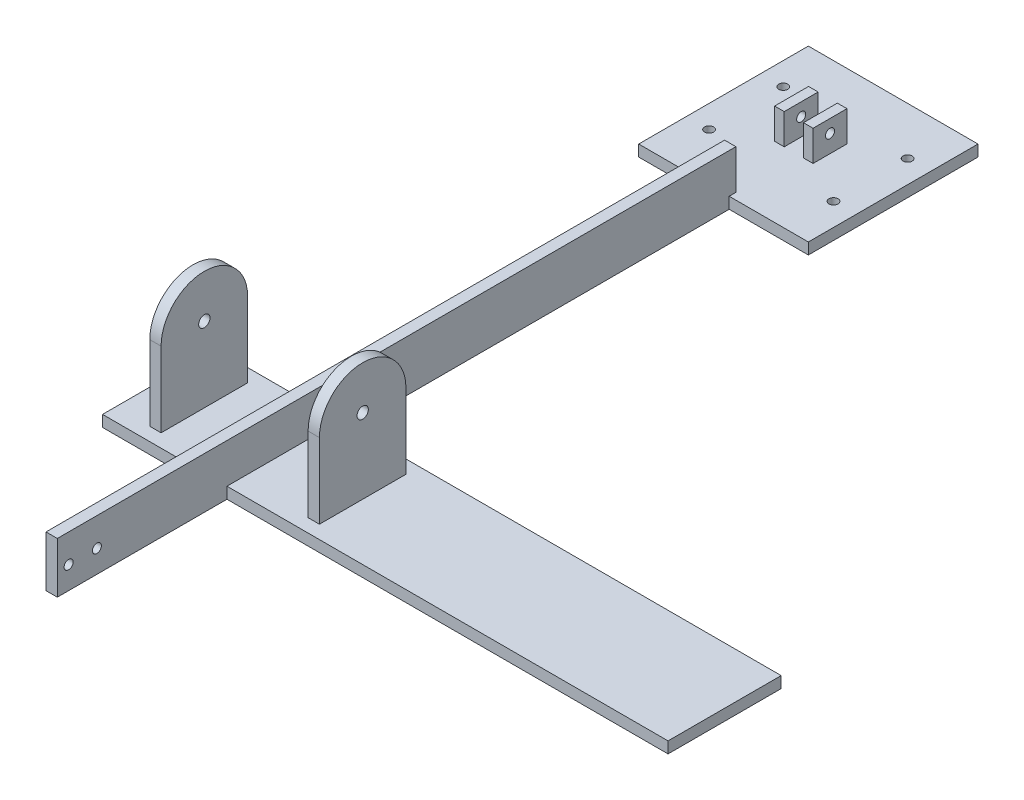
from build123d import *

# Parameters (mm, degrees)
SKETCH2_W           = 150
SKETCH2_H           = 150
SKETCH2_R           = 4
BOSS_EXTRUDE2_DEPTH = 10
SKETCH3_W           = 10
SKETCH3_H           = 600
BOSS_EXTRUDE3_DEPTH = 45
SKETCH4_W           = 500
SKETCH4_H           = 100
BOSS_EXTRUDE4_DEPTH = 10
SKETCH5_R           = 5
BOSS_EXTRUDE5_DEPTH = 10
SKETCH7_W           = 30
SKETCH7_H           = 27
SKETCH7_R           = 4
BOSS_EXTRUDE6_DEPTH = 8.5
SKETCH8_R           = 4
CUT_EXTRUDE1_DEPTH  = 720.805795864


with BuildPart() as part:
    # Sketch2 → Boss-Extrude2 (new body)
    with BuildSketch(Plane(origin=(0, 0, 0), x_dir=(1, 0, 0), z_dir=(0, 1, 0))):
        with Locations((-75, 75)):
            Rectangle(SKETCH2_W, SKETCH2_H)
        with Locations(Location((-130, 42.241144312, 0), (0, 0, 270))):
            Circle(SKETCH2_R, mode=Mode.SUBTRACT)
        with Locations(Location((-20, 42.241144312, 0), (0, 0, 270))):
            Circle(SKETCH2_R, mode=Mode.SUBTRACT)
        with Locations(Location((-20, 107.758855688, 0), (0, 0, 90))):
            Circle(SKETCH2_R, mode=Mode.SUBTRACT)
        with Locations(Location((-130, 107.758855688, 0), (0, 0, 90))):
            Circle(SKETCH2_R, mode=Mode.SUBTRACT)
    extrude(amount=BOSS_EXTRUDE2_DEPTH)

    # Sketch3 → Boss-Extrude3 (add)
    with BuildSketch(Plane(origin=(0, 0, 0), x_dir=(1, 0, 0), z_dir=(0, 1, 0))):
        with Locations((-75, -294.045278836)):
            Rectangle(SKETCH3_W, SKETCH3_H)
    extrude(amount=BOSS_EXTRUDE3_DEPTH)

    # Sketch4 → Boss-Extrude4 (add)
    with BuildSketch(Plane(origin=(0, 0, 0), x_dir=(1, 0, 0), z_dir=(0, 1, 0))):
        with Locations((70, -394.045278836)):
            Rectangle(SKETCH4_W, SKETCH4_H)
    extrude(amount=BOSS_EXTRUDE4_DEPTH)

    # Sketch5 → Boss-Extrude5 (add)
    with BuildSketch(Plane(origin=(0, 0, 0), x_dir=(0, 0, -1), z_dir=(1, 0, 0))):
        with BuildLine():
            Line((-432.285278836, 10), (-432.285278836, 76.348788506))
            ThreePointArc((-432.285278836, 76.348788506), (-421.085042149, 103.388551818), (-394.045278836, 114.588788506))
            ThreePointArc((-394.045278836, 114.588788506), (-367.005515524, 103.388551818), (-355.805278836, 76.348788506))
            Line((-355.805278836, 76.348788506), (-355.805278836, 10))
            Line((-355.805278836, 10), (-432.285278836, 10))
        make_face()
        with Locations((-394.045278836, 76.348788506)):
            Circle(SKETCH5_R, mode=Mode.SUBTRACT)
    boss_extrude5 = extrude(amount=-BOSS_EXTRUDE5_DEPTH)

    # Mirror1: Boss-Extrude5 across plane
    add(boss_extrude5.mirror(Plane(origin=(-75, 0, 0), x_dir=(0, 0, 1), z_dir=(1, 0, 0))))

    # Sketch7 → Boss-Extrude6 (add)
    with BuildSketch(Plane(origin=(-58, 0, 0), x_dir=(0, 0, -1), z_dir=(1, 0, 0))):
        with Locations((77.164979512, 23.5)):
            Rectangle(SKETCH7_W, SKETCH7_H)
        with Locations((77.164979512, 25.524498442)):
            Circle(SKETCH7_R, mode=Mode.SUBTRACT)
    boss_extrude6 = extrude(amount=-BOSS_EXTRUDE6_DEPTH)

    # Mirror2: Boss-Extrude6 across plane
    add(boss_extrude6.mirror(Plane(origin=(-75, 0, 0), x_dir=(0, 0, 1), z_dir=(1, 0, 0))))

    # Sketch8 → Cut-Extrude1 (cut, through all)
    with BuildSketch(Plane(origin=(-70, 0, 0), x_dir=(0, 0, -1), z_dir=(1, 0, 0))):
        with Locations((-584.045278836, 20)):
            Circle(SKETCH8_R)
        with Locations((-559.045278836, 20)):
            Circle(SKETCH8_R)
    extrude(amount=-CUT_EXTRUDE1_DEPTH, mode=Mode.SUBTRACT)


solid = part.part
